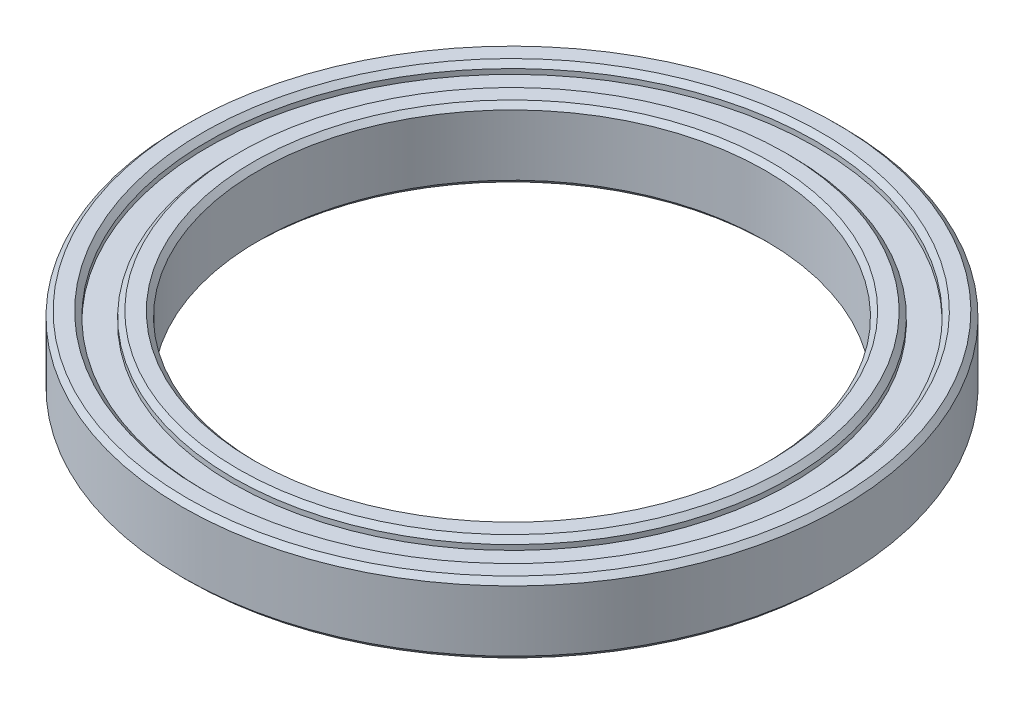
from build123d import *

# Parameters (mm, degrees)
SKETCH1_R           = 32.5
SKETCH1_R_2         = 25
BOSS_EXTRUDE1_DEPTH = 7
SKETCH2_R           = 30
SKETCH2_R_2         = 27.5
CUT_EXTRUDE1_DEPTH  = 1
CUT_EXTRUDE2_START  = -1
SKETCH3_R           = 30
SKETCH3_R_2         = 27.5
CUT_EXTRUDE2_DEPTH  = 1
CHAMFER1_SIZE       = 0.5


with BuildPart() as part:
    # Sketch1 → Boss-Extrude1 (new body)
    with BuildSketch(Plane(origin=(0, 0, 0), x_dir=(1, 0, 0), z_dir=(0, 1, 0))):
        with Locations(Location((0, 0, 0), (0, 0, 270))):
            Circle(SKETCH1_R)
        with Locations(Location((0, 0, 0), (0, 0, 270))):
            Circle(SKETCH1_R_2, mode=Mode.SUBTRACT)
    extrude(amount=BOSS_EXTRUDE1_DEPTH)

    # Sketch2 → Cut-Extrude1 (cut)
    with BuildSketch(Plane(origin=(0, 7, 0), x_dir=(1, 0, 0), z_dir=(0, 1, 0))):
        with Locations(Location((0, 0, 0), (0, 0, 270))):
            Circle(SKETCH2_R)
        with Locations(Location((0, 0, 0), (0, 0, 270))):
            Circle(SKETCH2_R_2, mode=Mode.SUBTRACT)
    extrude(amount=-CUT_EXTRUDE1_DEPTH, mode=Mode.SUBTRACT)

    # Sketch3 → Cut-Extrude2 (cut)
    with BuildSketch(Plane.XZ.offset(CUT_EXTRUDE2_START)):
        with Locations(Location((0, 0, 0), (0, 0, 90))):
            Circle(SKETCH3_R)
        with Locations(Location((0, 0, 0), (0, 0, 90))):
            Circle(SKETCH3_R_2, mode=Mode.SUBTRACT)
    extrude(amount=CUT_EXTRUDE2_DEPTH, mode=Mode.SUBTRACT)

    # Chamfer1
    chamfer1_edges = [part.edges().sort_by_distance(p)[0] for p in [
        (0, 7, -30),
        (0, 7, -27.5),
        (0, 0, -32.5),
        (0, 0, -30),
        (0, 0, -27.5),
        (0, 7, -32.5),
        (0, 0, -25),
        (0, 7, -25),
    ]]
    chamfer(chamfer1_edges, length=CHAMFER1_SIZE)


solid = part.part
